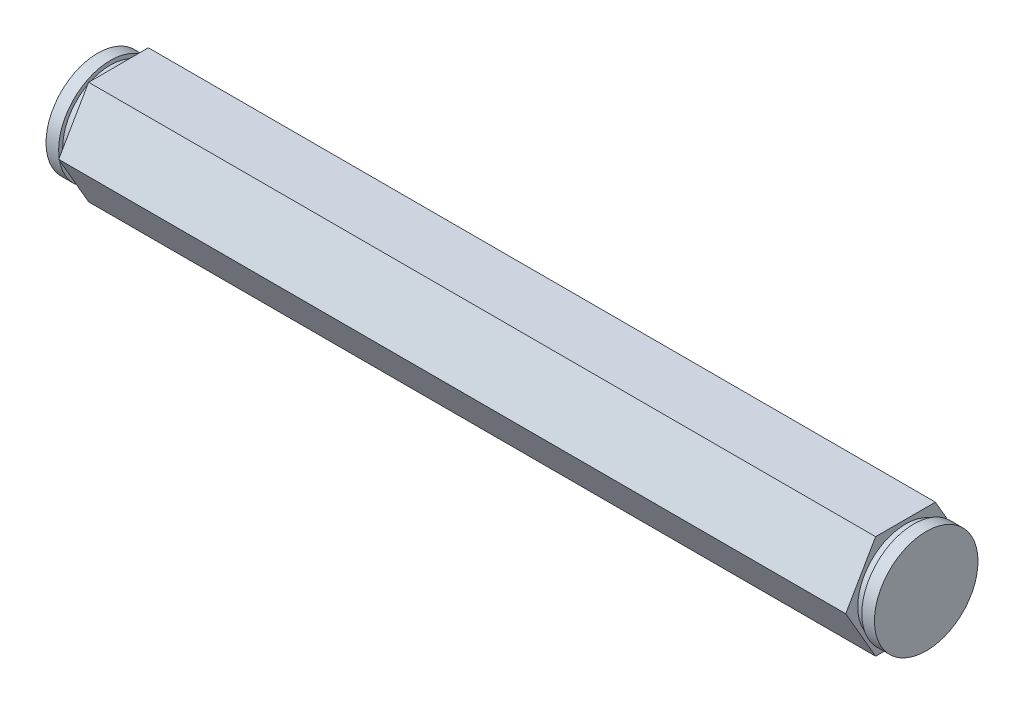
from build123d import *

# Parameters (mm, degrees)
BOSS_EXTRUDE1_DEPTH = 50.8


with BuildPart() as part:
    # Sketch1 → Boss-Extrude1 (new, symmetric)
    with BuildSketch(Plane(origin=(0, 0, 0), x_dir=(0, 0, -1), z_dir=(1, 0, 0))):
        Polygon((7.332348419, 0), (3.666174209, 6.35), (-3.666174209, 6.35), (-7.332348419, 0), (-3.666174209, -6.35), (3.666174209, -6.35), align=None)
    extrude(amount=BOSS_EXTRUDE1_DEPTH, both=True)

    # Sketch2 → Cut-Revolve1 (revolve, cut)
    with BuildSketch(Plane(origin=(0, 0, 0), x_dir=(1, 0, 0), z_dir=(0, 1, 0))):
        Polygon((48.26, -5.8547), (49.2506, -5.8547), (49.2506, -6.35), (50.8, -6.35), (50.8, -8.89), (48.26, -8.89), align=None)
    cut_revolve1 = revolve(axis=Axis((0, 0, 0), (1, 0, 0)), mode=Mode.SUBTRACT)

    # Mirror1: Cut-Revolve1 across plane
    add(cut_revolve1.mirror(Plane(origin=(0, 0, 0), x_dir=(0, 0, 1), z_dir=(1, 0, 0))), mode=Mode.SUBTRACT)


solid = part.part
